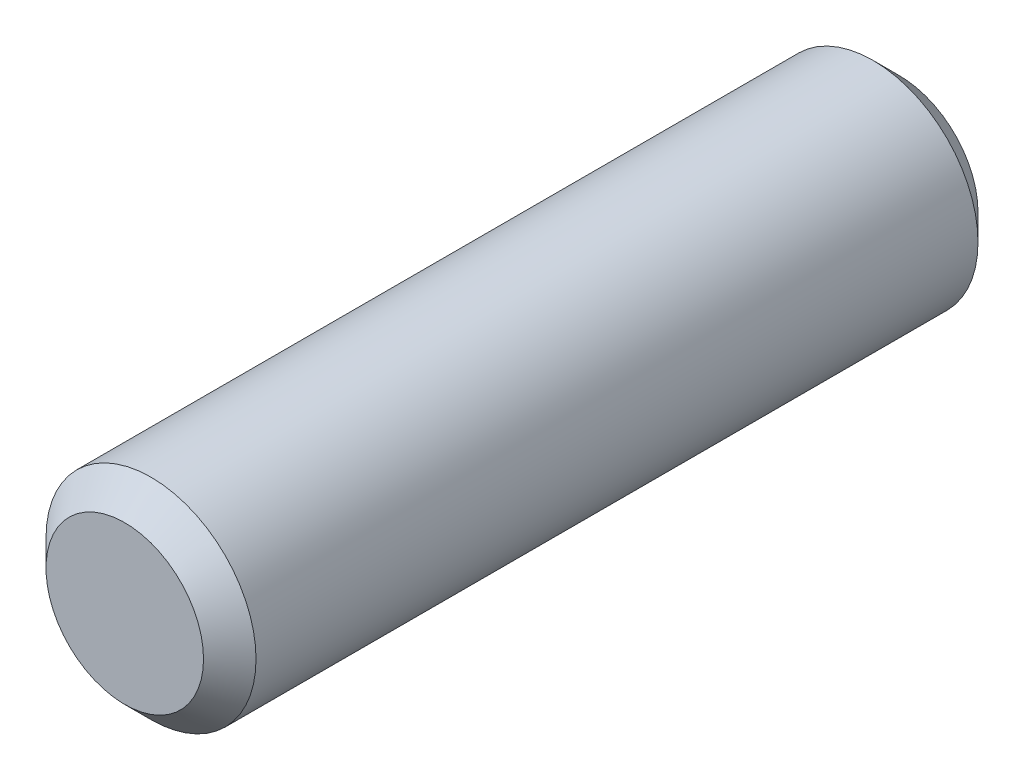
from build123d import *

# Parameters (mm, degrees)
SKETCH_1_R      = 4
EXTRUDE_1_DEPTH = 14.75
CHAMFER_1_SIZE  = 1


with BuildPart() as part:
    # 스케치1 → 보스-돌출1 (new, symmetric)
    with BuildSketch(Plane.XY):
        Circle(SKETCH_1_R)
    extrude(amount=EXTRUDE_1_DEPTH, both=True)

    # 모따기1
    chamfer_1_edges = [part.edges().sort_by_distance(p)[0] for p in [
        (-4, 0, -14.75),
        (-4, 0, 14.75),
    ]]
    chamfer(chamfer_1_edges, length=CHAMFER_1_SIZE)


solid = part.part
